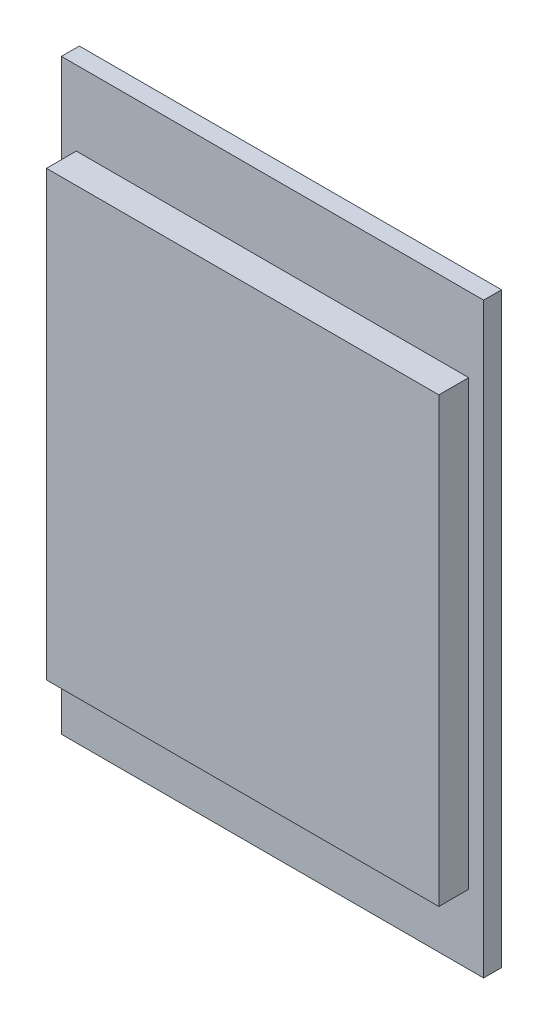
from build123d import *

# Parameters (mm, degrees)
SKETCH_1_W      = 28.3
SKETCH_1_H      = 39.35
EXTRUDE_1_DEPTH = 1.2
SKETCH_2_W      = 26.3
SKETCH_2_H      = 29.7
EXTRUDE_2_DEPTH = 2


with BuildPart() as part:
    # Эскиз1 → Бобышка-Вытянуть1 (new body)
    with BuildSketch(Plane.XY):
        Rectangle(SKETCH_1_W, SKETCH_1_H)
    extrude(amount=EXTRUDE_1_DEPTH)

    # Эскиз2 → Бобышка-Вытянуть2 (add)
    with BuildSketch(Plane.XY.offset(1.2)):
        with Locations((0, -0.175)):
            Rectangle(SKETCH_2_W, SKETCH_2_H)
    extrude(amount=EXTRUDE_2_DEPTH)


solid = part.part
